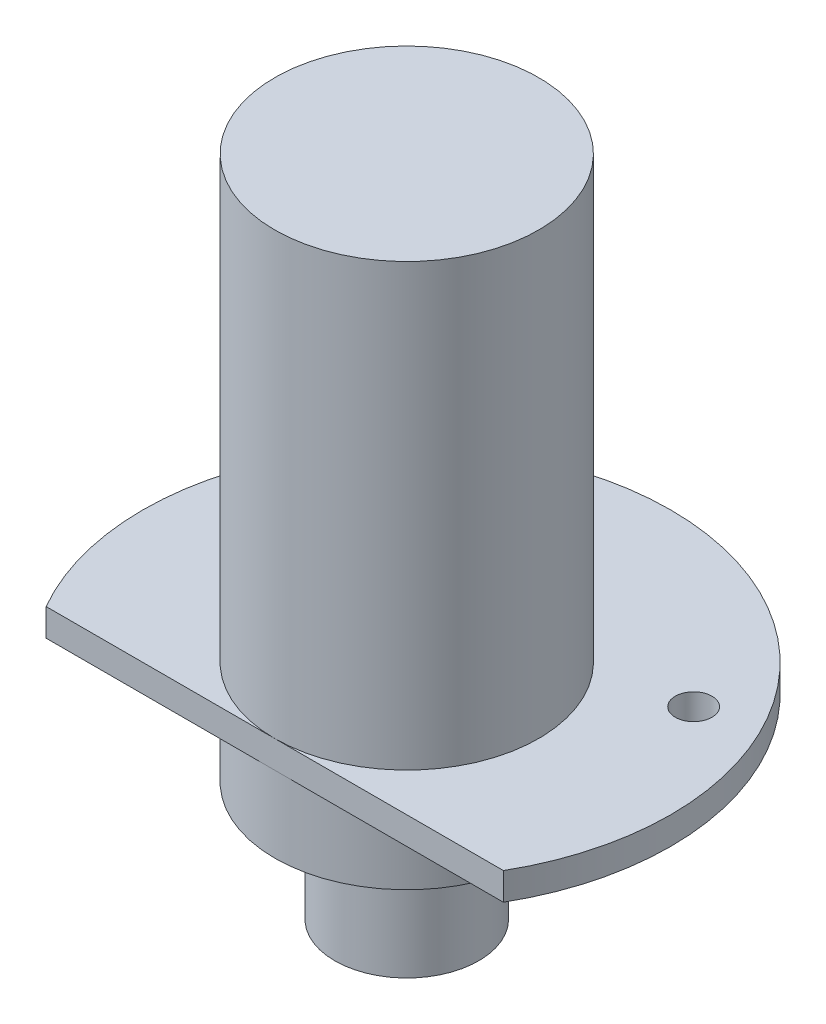
from build123d import *

# Parameters (mm, degrees)
SKETCH2_R               = 1.526999994
CUT_EXTRUDE1_DEPTH      = 50.881280215
CUT_EXTRUDE2_DEPTH      = 49.115592108
CUT_EXTRUDE2_DEPTH_BACK = 49.115592108


with BuildPart() as part:
    # Sketch1 → Revolve1 (revolve)
    with BuildSketch(Plane(origin=(0, 0, 0), x_dir=(0, 0, -1), z_dir=(1, 0, 0)), mode=Mode.PRIVATE) as revolve1_sk:
        Polygon((10.999999971, 18.542), (21.999999942, 18.542), (21.999999942, 16.256), (10.999999971, 16.256), (10.999999971, 9.906), (5.999999938, 9.906), (5.999999938, 0), (0, 0), (0, 55.245), (10.999999971, 55.245), align=None)
    revolve(revolve1_sk.sketch.rotate(Axis((0, 55.245, 0), (0, -1, 0)), 180), axis=Axis((0, 55.245, 0), (0, -1, 0)))

    # Sketch2 → Cut-Extrude1 (cut, through all)
    with BuildSketch(Plane.XZ.offset(-16.256)):
        with Locations(Location((0, 17.500000052, 0), (0, 0, 270))):
            Circle(SKETCH2_R)
        with Locations(Location((15.155444611, -8.750000026, 0), (0, 0, 270))):
            Circle(SKETCH2_R)
        with Locations(Location((-15.155444611, -8.750000026, 0), (0, 0, 270))):
            Circle(SKETCH2_R)
    extrude(amount=-CUT_EXTRUDE1_DEPTH, mode=Mode.SUBTRACT)

    # Sketch4 → Cut-Extrude2 (cut, two sides: drawn at the far end of the back side and taken through both)
    with BuildSketch(Plane(origin=(0, 18.542, 0), x_dir=(1, 0, 0), z_dir=(0, 1, 0)).offset(-CUT_EXTRUDE2_DEPTH_BACK)):
        with BuildLine():
            Line((-19.052558833, -10.999999971), (19.052558833, -10.999999971))
            ThreePointArc((19.052558833, -10.999999971), (0, -21.999999942), (-19.052558833, -10.999999971))
        make_face()
    extrude(amount=CUT_EXTRUDE2_DEPTH + CUT_EXTRUDE2_DEPTH_BACK, mode=Mode.SUBTRACT)


solid = part.part
